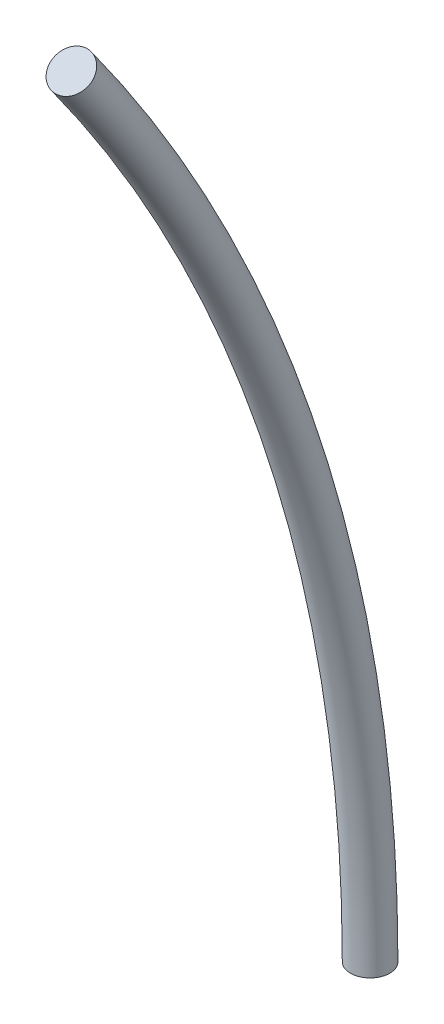
from build123d import *

# Parameters (mm, degrees)
SKETCH2_R = 3


with BuildPart() as part:
    # Sweep1: sweep along a path in Sketch1
    with BuildLine(Plane(origin=(0, 0, 0), x_dir=(0, 0, -1), z_dir=(1, 0, 0))) as sweep1_path:
        ThreePointArc((0, 0), (-11.669055525, 73.775632332), (-45.536996043, 140.348700369))
    # Sketch2 → Sweep1 (sweep)
    with BuildSketch(Plane(origin=(0, 0, 0), x_dir=(1, 0, 0), z_dir=(0, 1, 0))):
        Circle(SKETCH2_R)
    sweep(path=sweep1_path.line)


solid = part.part
